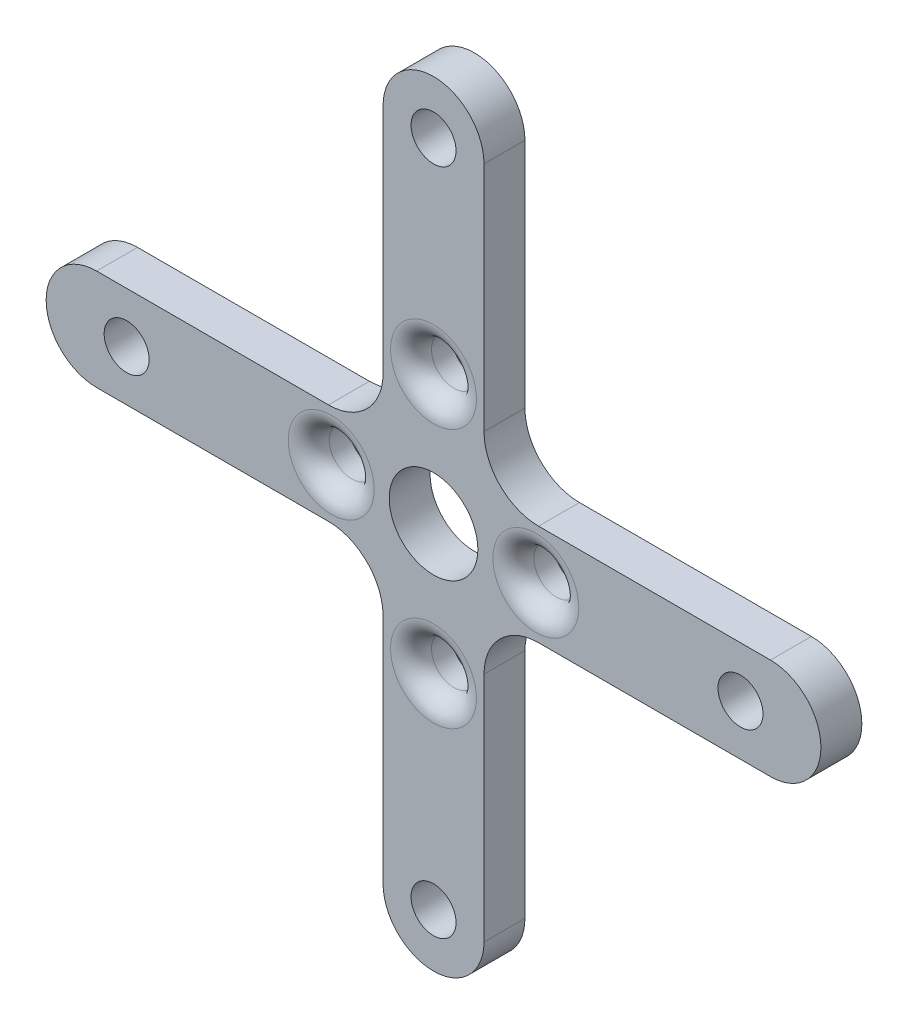
from build123d import *

# Parameters (mm, degrees)
SALIENTE_EXTRUIR2_DEPTH = 3
CROQUIS3_R              = 3.25
CROQUIS3_R_2            = 1.65
CORTAR_EXTRUIR1_DEPTH   = 3
REDONDEO1_R             = 1.5
REDONDEO2_R             = 1.5
REDONDEO3_R             = 1.5
REDONDEO4_R             = 1.5


with BuildPart() as part:
    # Croquis1 → Saliente-Extruir2 (new body)
    with BuildSketch(Plane.XY):
        with BuildLine():
            Line((-7.7, 3.7), (-24.7, 3.7))
            ThreePointArc((-24.7, 3.7), (-28.4, 0), (-24.7, -3.7))
            Line((-24.7, -3.7), (-7.7, -3.7))
            ThreePointArc((-7.7, -3.7), (-4.871572875, -4.871572875), (-3.7, -7.7))
            Line((-3.7, -7.7), (-3.7, -24.7))
            ThreePointArc((-3.7, -24.7), (0, -28.4), (3.7, -24.7))
            Line((3.7, -24.7), (3.7, -7.7))
            ThreePointArc((3.7, -7.7), (4.871572875, -4.871572875), (7.7, -3.7))
            Line((7.7, -3.7), (24.7, -3.7))
            ThreePointArc((24.7, -3.7), (28.4, 0), (24.7, 3.7))
            Line((24.7, 3.7), (7.7, 3.7))
            ThreePointArc((7.7, 3.7), (4.871572875, 4.871572875), (3.7, 7.7))
            Line((3.7, 7.7), (3.7, 24.7))
            ThreePointArc((3.7, 24.7), (0, 28.4), (-3.7, 24.7))
            Line((-3.7, 24.7), (-3.7, 7.7))
            ThreePointArc((-3.7, 7.7), (-4.871572875, 4.871572875), (-7.7, 3.7))
        make_face()
    extrude(amount=SALIENTE_EXTRUIR2_DEPTH)

    # Croquis3 → Cortar-Extruir1 (cut)
    with BuildSketch(Plane.XY.offset(3)):
        Circle(CROQUIS3_R)
        with Locations((-7.5, 0)):
            Circle(CROQUIS3_R_2)
        with Locations((-22.5, 0)):
            Circle(CROQUIS3_R_2)
        with Locations((0, -9.5)):
            Circle(CROQUIS3_R_2)
        with Locations((7.5, 0)):
            Circle(CROQUIS3_R_2)
        with Locations((0, 9.5)):
            Circle(CROQUIS3_R_2)
        with Locations((0, 24.5)):
            Circle(CROQUIS3_R_2)
        with Locations((22.5, 0)):
            Circle(CROQUIS3_R_2)
        with Locations((0, -24.5)):
            Circle(CROQUIS3_R_2)
    extrude(amount=-CORTAR_EXTRUIR1_DEPTH, mode=Mode.SUBTRACT)

    # Redondeo1
    redondeo1_edges = [part.edges().sort_by_distance(p)[0] for p in [
        (-9.15, 0, 3),
    ]]
    fillet(redondeo1_edges, radius=REDONDEO1_R)

    # Redondeo2
    redondeo2_edges = [part.edges().sort_by_distance(p)[0] for p in [
        (-1.65, 9.5, 3),
    ]]
    fillet(redondeo2_edges, radius=REDONDEO2_R)

    # Redondeo3
    redondeo3_edges = [part.edges().sort_by_distance(p)[0] for p in [
        (5.85, 0, 3),
    ]]
    fillet(redondeo3_edges, radius=REDONDEO3_R)

    # Redondeo4
    redondeo4_edges = [part.edges().sort_by_distance(p)[0] for p in [
        (-1.65, -9.5, 3),
    ]]
    fillet(redondeo4_edges, radius=REDONDEO4_R)


solid = part.part
